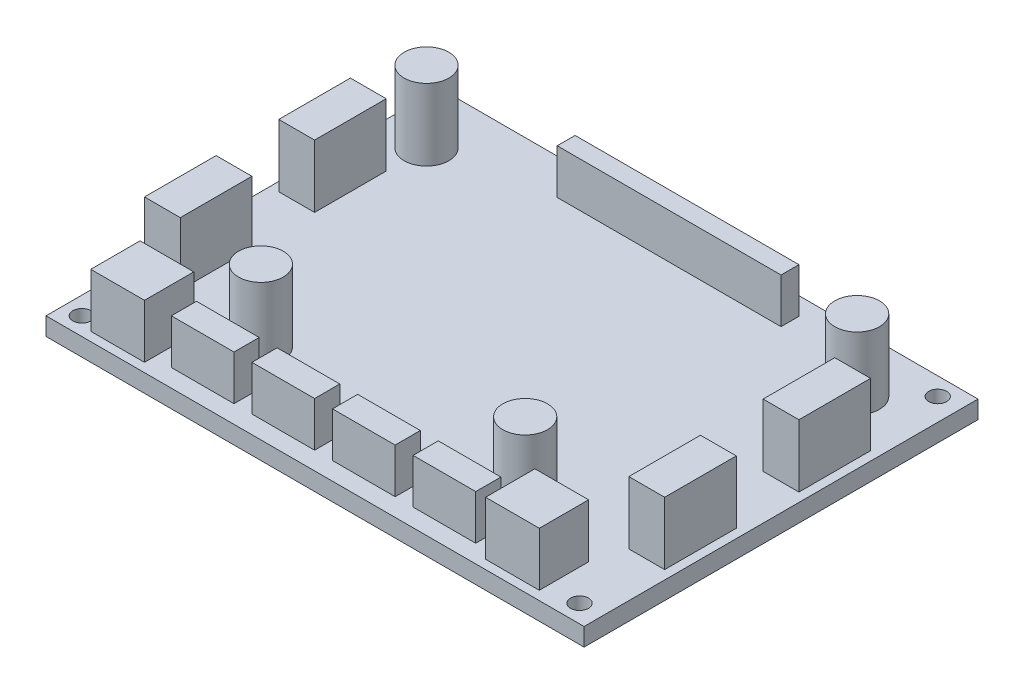
from build123d import *

# Parameters (mm, degrees)
SKETCH1_W           = 95.40875
SKETCH1_H           = 69.85
BOSS_EXTRUDE1_DEPTH = 3.175
SKETCH1_4_R         = 3.96875
BOSS_EXTRUDE2_DEPTH = 15.875
SKETCH1_5_W         = 6.35
SKETCH1_5_H         = 12.7
BOSS_EXTRUDE3_DEPTH = 14.2875
SKETCH1_6_W         = 39.6875
SKETCH1_6_H         = 3.175
BOSS_EXTRUDE4_DEPTH = 11.1125
SKETCH1_8_R         = 1.5875
CUT_EXTRUDE4_DEPTH  = 104.830931221
SKETCH1_9_W         = 11.1125
SKETCH1_9_H         = 4.464487979
BOSS_EXTRUDE5_DEPTH = 11.1125
SKETCH1_10_W        = 9.525
SKETCH1_10_H        = 8.739789678
BOSS_EXTRUDE6_DEPTH = 12.7


with BuildPart() as part:
    # Sketch1 → Boss-Extrude1 (new body)
    with BuildSketch(Plane(origin=(0, 0, 0), x_dir=(1, 0, 0), z_dir=(0, 1, 0))):
        with Locations((-27.460937167, 34.925)):
            Rectangle(SKETCH1_W, SKETCH1_H)
    extrude(amount=BOSS_EXTRUDE1_DEPTH)

    # Sketch1<4> → Boss-Extrude2 (add)
    with BuildSketch(Plane(origin=(0, 0, 0), x_dir=(1, 0, 0), z_dir=(0, 1, 0))):
        with Locations(Location((-51.352812167, 14.2875, 0), (0, 0, 270))):
            Circle(SKETCH1_4_R)
        with Locations(Location((-4.486033595, 14.2875, 0), (0, 0, 270))):
            Circle(SKETCH1_4_R)
        with Locations(Location((9.130937833, 59.53125, 0), (0, 0, 270))):
            Circle(SKETCH1_4_R)
        with Locations(Location((-67.227812167, 59.53125, 0), (0, 0, 270))):
            Circle(SKETCH1_4_R)
    extrude(amount=BOSS_EXTRUDE2_DEPTH)

    # Sketch1<5> → Boss-Extrude3 (add)
    with BuildSketch(Plane(origin=(0, 0, 0), x_dir=(1, 0, 0), z_dir=(0, 1, 0))):
        with Locations((-70.402812167, 46.0375)):
            Rectangle(SKETCH1_5_W, SKETCH1_5_H)
        with Locations((-70.402812167, 22.225)):
            Rectangle(SKETCH1_5_W, SKETCH1_5_H)
        with Locations((15.480937833, 22.225)):
            Rectangle(SKETCH1_5_W, SKETCH1_5_H)
        with Locations((15.480937833, 46.0375)):
            Rectangle(SKETCH1_5_W, SKETCH1_5_H)
    extrude(amount=BOSS_EXTRUDE3_DEPTH)

    # Sketch1<6> → Boss-Extrude4 (add)
    with BuildSketch(Plane(origin=(0, 0, 0), x_dir=(1, 0, 0), z_dir=(0, 1, 0))):
        with Locations((-28.175312167, 65.0875)):
            Rectangle(SKETCH1_6_W, SKETCH1_6_H)
    extrude(amount=BOSS_EXTRUDE4_DEPTH)

    # Sketch1<8> → Cut-Extrude4 (cut, through all)
    with BuildSketch(Plane(origin=(0, 0, 0), x_dir=(1, 0, 0), z_dir=(0, 1, 0))):
        with Locations(Location((-71.990312167, 66.675, 0), (0, 0, 270))):
            Circle(SKETCH1_8_R)
        with Locations(Location((16.274687833, 3.175, 0), (0, 0, 90))):
            Circle(SKETCH1_8_R)
        with Locations(Location((16.274687833, 66.675, 0), (0, 0, 270))):
            Circle(SKETCH1_8_R)
        with Locations(Location((-71.990312167, 3.175, 0), (0, 0, 90))):
            Circle(SKETCH1_8_R)
    extrude(amount=CUT_EXTRUDE4_DEPTH, mode=Mode.SUBTRACT)

    # Sketch1<9> → Boss-Extrude5 (add)
    with BuildSketch(Plane(origin=(0, 0, 0), x_dir=(1, 0, 0), z_dir=(0, 1, 0))):
        with Locations((-36.271562167, 5.40724399)):
            Rectangle(SKETCH1_9_W, SKETCH1_9_H)
        with Locations((-21.984062167, 5.40724399)):
            Rectangle(SKETCH1_9_W, SKETCH1_9_H)
        with Locations((-7.696562167, 5.40724399)):
            Rectangle(SKETCH1_9_W, SKETCH1_9_H)
        with Locations((-50.559062167, 5.40724399)):
            Rectangle(SKETCH1_9_W, SKETCH1_9_H)
    extrude(amount=BOSS_EXTRUDE5_DEPTH)

    # Sketch1<10> → Boss-Extrude6 (add)
    with BuildSketch(Plane(origin=(0, 0, 0), x_dir=(1, 0, 0), z_dir=(0, 1, 0))):
        with Locations((-64.052812167, 5.957394839)):
            Rectangle(SKETCH1_10_W, SKETCH1_10_H)
        with Locations((5.955937833, 5.957394839)):
            Rectangle(SKETCH1_10_W, SKETCH1_10_H)
    extrude(amount=BOSS_EXTRUDE6_DEPTH)


solid = part.part
